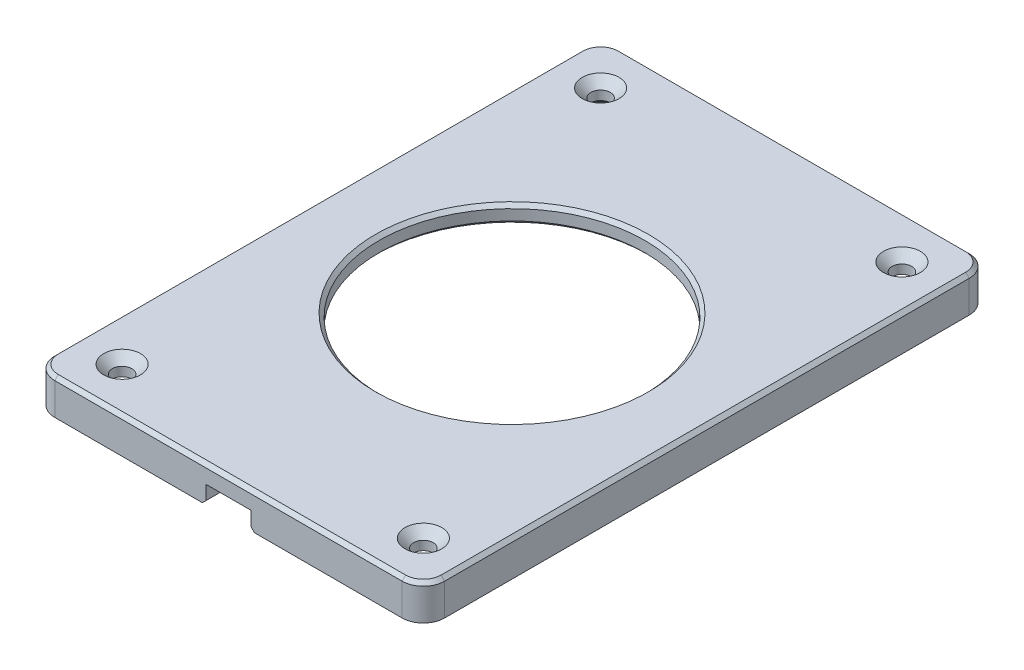
from build123d import *

# Parameters (mm, degrees)
SKETCH1_W                                      = 100
SKETCH1_H                                      = 150
BOSS_EXTRUDE1_DEPTH                            = 2.5
CSK_FOR_M5_FLAT_HEAD_MACHINE_SCREW1_AT_2_COUNT = 2
CSK_FOR_M5_FLAT_HEAD_MACHINE_SCREW1_AT_2_PITCH = 85
CSK_FOR_M5_FLAT_HEAD_MACHINE_SCREW1_AT_3_COUNT = 2
CSK_FOR_M5_FLAT_HEAD_MACHINE_SCREW1_AT_3_PITCH = 159.530561335
CSK_FOR_M5_FLAT_HEAD_MACHINE_SCREW1_AT_4_COUNT = 2
CSK_FOR_M5_FLAT_HEAD_MACHINE_SCREW1_AT_4_PITCH = 135
SKETCH5_W                                      = 110
SKETCH5_H                                      = 160
SKETCH5_W_2                                    = 100
SKETCH5_H_2                                    = 150
BOSS_EXTRUDE2_DEPTH                            = 10
SKETCH6_W                                      = 12.7
SKETCH6_H                                      = 5
CUT_EXTRUDE1_DEPTH                             = 5
FILLET1_R                                      = 6
CUT_EXTRUDE2_DEPTH                             = 98.59610648
CUT_EXTRUDE2_DEPTH_BACK                        = 98.59610648
SKETCH7_R                                      = 37.5
CHAMFER2_SIZE                                  = 1


with BuildPart() as part:
    # Sketch1 → Boss-Extrude1 (new, symmetric)
    with BuildSketch(Plane(origin=(0, 0, 0), x_dir=(1, 0, 0), z_dir=(0, 1, 0))):
        Rectangle(SKETCH1_W, SKETCH1_H)
    extrude(amount=BOSS_EXTRUDE1_DEPTH, both=True)

    # Sketch4 → CSK for M5 Flat Head Machine Screw1 (revolve, cut)
    with BuildSketch(Plane(origin=(-42.5, 2.5, -67.5), x_dir=(0, 0, 1), z_dir=(1, 0, 0))):
        Polygon((0, 0), (0, 5), (2.75, 5), (2.75, 2.45), (5.2, 0), align=None)
    csk_for_m5_flat_head_machine_screw1 = revolve(axis=Axis((-42.5, 8.85, -67.5), (0, -1, 0)), mode=Mode.SUBTRACT)

    # CSK for M5 Flat Head Machine Screw1 at 2: CSK for M5 Flat Head Machine Screw1 ×2
    with Locations(*[(i * CSK_FOR_M5_FLAT_HEAD_MACHINE_SCREW1_AT_2_PITCH, 0, 0) for i in range(1, CSK_FOR_M5_FLAT_HEAD_MACHINE_SCREW1_AT_2_COUNT)]):
        add(csk_for_m5_flat_head_machine_screw1, mode=Mode.SUBTRACT)

    # CSK for M5 Flat Head Machine Screw1 at 3: CSK for M5 Flat Head Machine Screw1 ×2
    with Locations(*[Vector(0.5328132696861391, 0, 0.8462328400897507) * (i * CSK_FOR_M5_FLAT_HEAD_MACHINE_SCREW1_AT_3_PITCH) for i in range(1, CSK_FOR_M5_FLAT_HEAD_MACHINE_SCREW1_AT_3_COUNT)]):
        add(csk_for_m5_flat_head_machine_screw1, mode=Mode.SUBTRACT)

    # CSK for M5 Flat Head Machine Screw1 at 4: CSK for M5 Flat Head Machine Screw1 ×2
    with Locations(*[(0, 0, i * CSK_FOR_M5_FLAT_HEAD_MACHINE_SCREW1_AT_4_PITCH) for i in range(1, CSK_FOR_M5_FLAT_HEAD_MACHINE_SCREW1_AT_4_COUNT)]):
        add(csk_for_m5_flat_head_machine_screw1, mode=Mode.SUBTRACT)

    # Sketch5 → Boss-Extrude2 (add)
    with BuildSketch(Plane(origin=(0, 2.5, 0), x_dir=(1, 0, 0), z_dir=(0, 1, 0))):
        Rectangle(SKETCH5_W, SKETCH5_H)
        Rectangle(SKETCH5_W_2, SKETCH5_H_2, mode=Mode.SUBTRACT)
    extrude(amount=-BOSS_EXTRUDE2_DEPTH)

    # Sketch6 → Cut-Extrude1 (cut)
    with BuildSketch(Plane.XZ.offset(7.5)):
        with Locations((0, 77.5)):
            Rectangle(SKETCH6_W, SKETCH6_H)
    extrude(amount=-CUT_EXTRUDE1_DEPTH, mode=Mode.SUBTRACT)

    # Fillet1
    fillet1_edges = [part.edges().sort_by_distance(p)[0] for p in [
        (55, -2.5, -80),
        (55, -2.5, 80),
        (-55, -2.5, 80),
        (-55, -2.5, -80),
        (-50, -5, -75),
        (50, -5, -75),
        (50, -5, 75),
        (-50, -5, 75),
    ]]
    fillet(fillet1_edges, radius=FILLET1_R)

    # Sketch7 → Cut-Extrude2 (cut, two sides: drawn at the far end of the back side and taken through both)
    with BuildSketch(Plane(origin=(0, 2.5, 0), x_dir=(1, 0, 0), z_dir=(0, 1, 0)).offset(-CUT_EXTRUDE2_DEPTH_BACK)):
        with Locations(Location((0, 0, 0), (0, 0, 90))):
            Circle(SKETCH7_R)
    extrude(amount=CUT_EXTRUDE2_DEPTH + CUT_EXTRUDE2_DEPTH_BACK, mode=Mode.SUBTRACT)

    # Chamfer2
    chamfer2_edges = [part.edges().sort_by_distance(p)[0] for p in [
        (-48.242640687, -7.5, -73.242640687),
        (48.242640687, -7.5, -73.242640687),
        (48.242640687, -7.5, 73.242640687),
        (-48.242640687, -7.5, 73.242640687),
        (0, 2.5, 37.5),
        (0, -2.5, 37.5),
        (25.175, -7.5, 75),
        (6.35, -7.5, 77.5),
        (-6.35, -7.5, 77.5),
        (0, 2.5, 80),
        (55, 2.5, 0),
        (0, 2.5, -80),
        (-55, 2.5, 0),
        (-53.242640687, 2.5, 78.242640687),
        (-53.242640687, 2.5, -78.242640687),
        (53.242640687, 2.5, -78.242640687),
        (53.242640687, 2.5, 78.242640687),
        (50, -7.5, 0),
        (0, -7.5, -75),
        (-50, -7.5, 0),
        (-25.175, -7.5, 75),
    ]]
    chamfer(chamfer2_edges, length=CHAMFER2_SIZE)


solid = part.part
